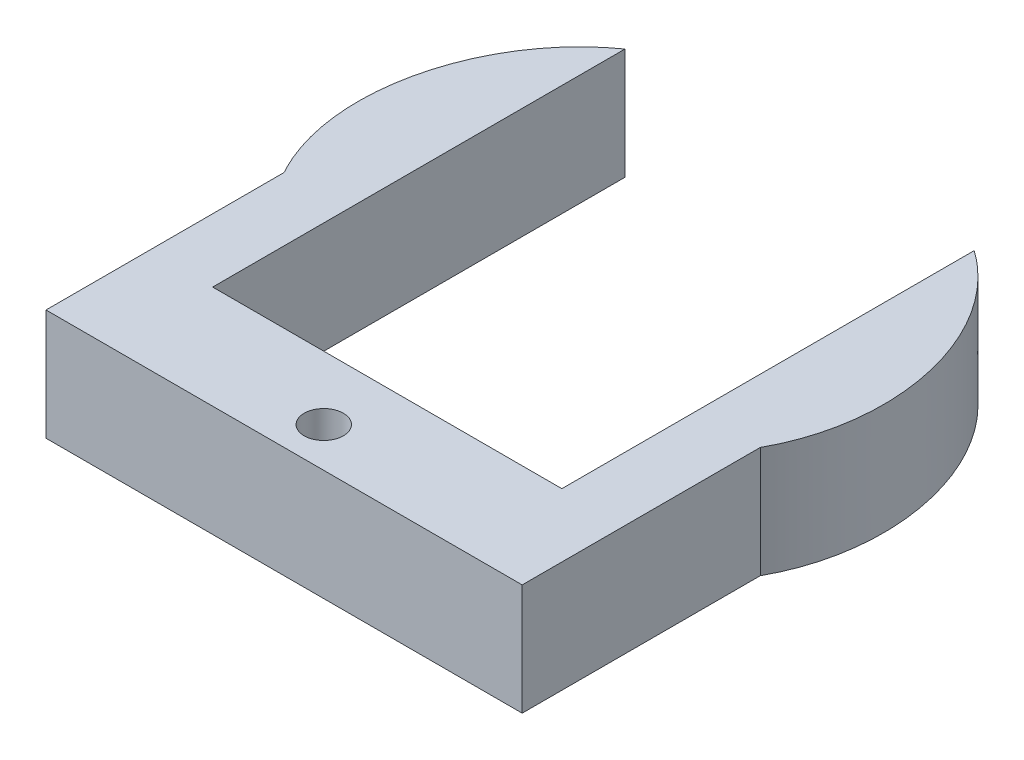
from build123d import *

# Parameters (mm, degrees)
BOSS_EXTRUDE1_DEPTH = 14
SKETCH3_R           = 2.469718116
CUT_EXTRUDE1_DEPTH  = 21


with BuildPart() as part:
    # Sketch1 → Boss-Extrude1 (new body)
    with BuildSketch(Plane(origin=(0, 0, 0), x_dir=(1, 0, 0), z_dir=(0, 1, 0))):
        with BuildLine():
            Line((8, 67.50149873), (8, 79.954057008))
            add(Edge.make_bspline(
                [(0, 45), (-4.267413412, 52.702157849), (-3.849710429, 67.232110416), (4.572220088, 77.524864833), (8, 79.954057008)],
                knots=[0, 0, 0, 0, 0.616858973, 0.90735247, 0.90735247, 0.90735247, 0.90735247], degree=3))
            Line((0, 45), (0, 15))
            Line((0, 15), (60, 15))
            Line((60, 15), (60, 45))
            add(Edge.make_bspline(
                [(60, 45), (64.267413412, 52.702157849), (63.849710429, 67.232110416), (55.427779912, 77.524864833), (52, 79.954057008)],
                knots=[0, 0, 0, 0, 0.616858973, 0.90735247, 0.90735247, 0.90735247, 0.90735247], degree=3))
            Line((52, 79.954057008), (52, 70.29729534))
            Line((52, 70.29729534), (52, 28))
            Line((52, 28), (8, 28))
            Line((8, 28), (8, 67.50149873))
        make_face()
    extrude(amount=BOSS_EXTRUDE1_DEPTH)

    # Sketch3 → Cut-Extrude1 (cut)
    with BuildSketch(Plane.XZ):
        with Locations(Location((30, -20, 0), (0, 0, 270))):
            Circle(SKETCH3_R)
    extrude(amount=-CUT_EXTRUDE1_DEPTH, mode=Mode.SUBTRACT)


solid = part.part
